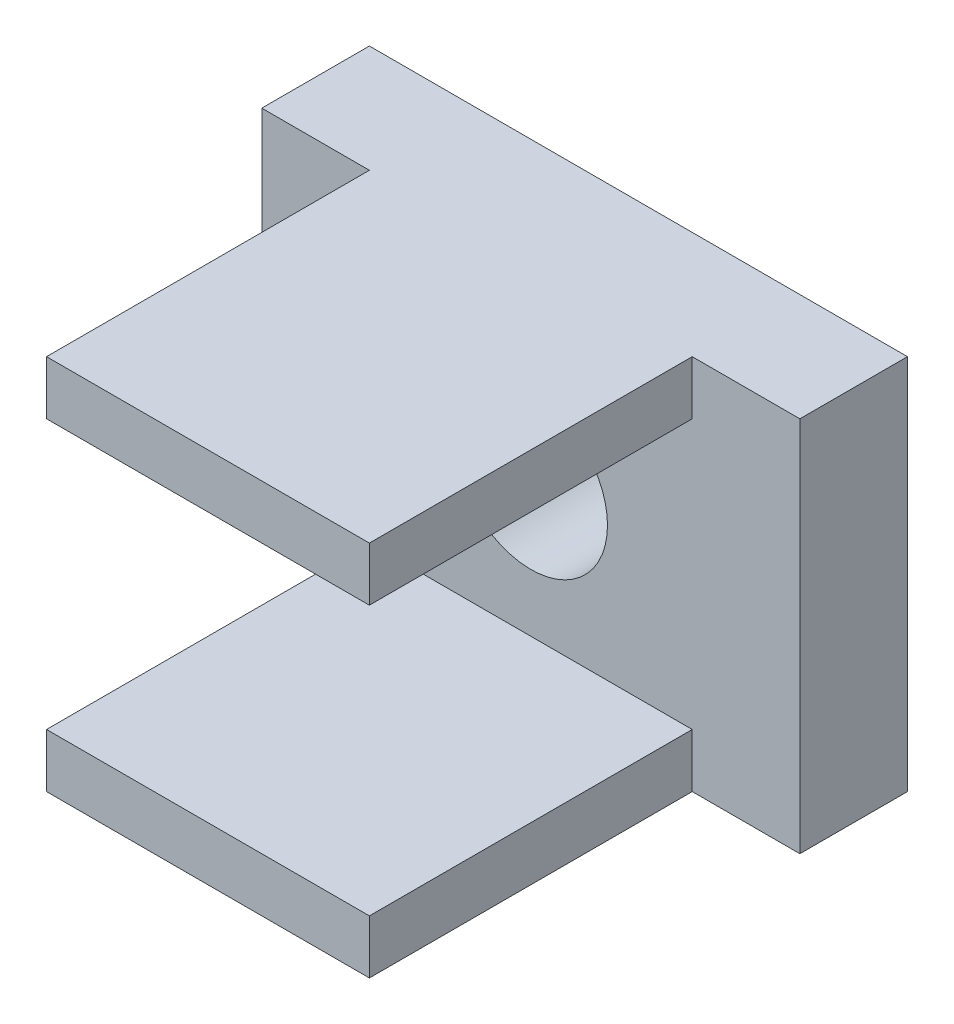
from build123d import *

# Parameters (mm, degrees)
SKETCH1_W           = 10
SKETCH1_H           = 7
BOSS_EXTRUDE1_DEPTH = 1
SKETCH2_R           = 1.425
CUT_EXTRUDE1_DEPTH  = 7.422616289
SKETCH3_W           = 6
SKETCH3_H           = 1
BOSS_EXTRUDE2_DEPTH = 6


with BuildPart() as part:
    # Sketch1 → Boss-Extrude1 (new, symmetric)
    with BuildSketch(Plane.XY):
        Rectangle(SKETCH1_W, SKETCH1_H)
    extrude(amount=BOSS_EXTRUDE1_DEPTH, both=True)

    # Sketch2 → Cut-Extrude1 (cut, through all)
    with BuildSketch(Plane.XY.offset(1)):
        Circle(SKETCH2_R)
    extrude(amount=-CUT_EXTRUDE1_DEPTH, mode=Mode.SUBTRACT)

    # Sketch3 → Boss-Extrude2 (add)
    with BuildSketch(Plane.XY.offset(1)):
        with Locations((0, 3)):
            Rectangle(SKETCH3_W, SKETCH3_H)
    boss_extrude2 = extrude(amount=BOSS_EXTRUDE2_DEPTH)

    # Mirror1: Boss-Extrude2 across plane
    add(boss_extrude2.mirror(Plane.ZX))


solid = part.part
